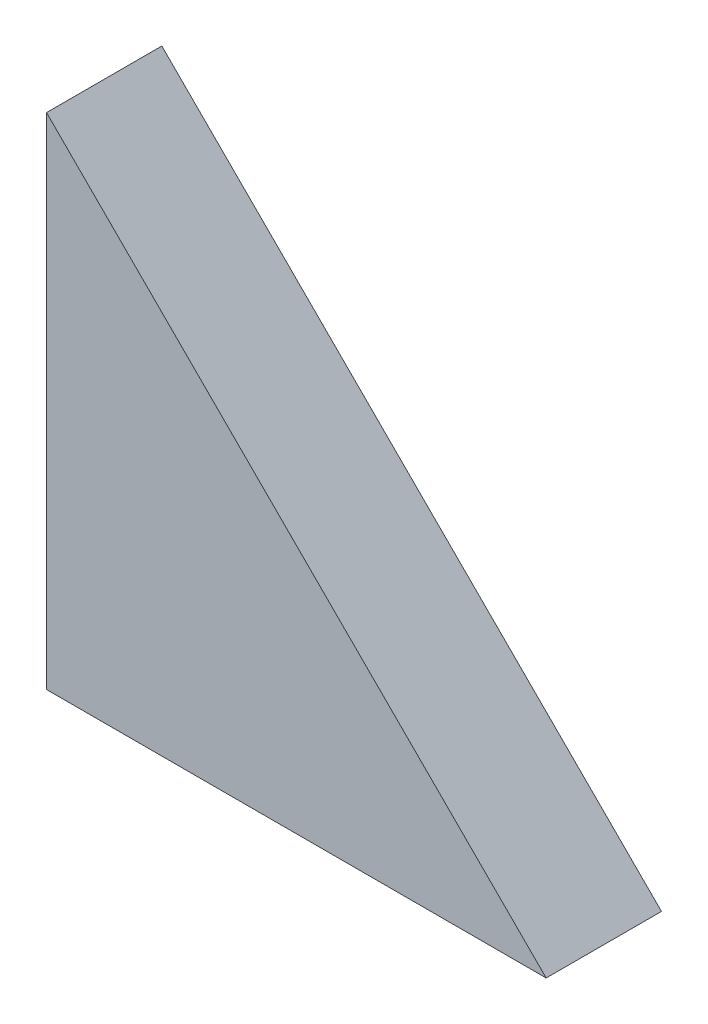
from build123d import *

# Parameters (mm, degrees)
BOSS_EXTRUDE1_DEPTH = 38.1


with BuildPart() as part:
    # Sketch1 → Boss-Extrude1 (new body)
    with BuildSketch(Plane.XY):
        Polygon((0, 0), (0, 165.099997208), (165.099997208, 0), align=None)
    extrude(amount=BOSS_EXTRUDE1_DEPTH)


solid = part.part
